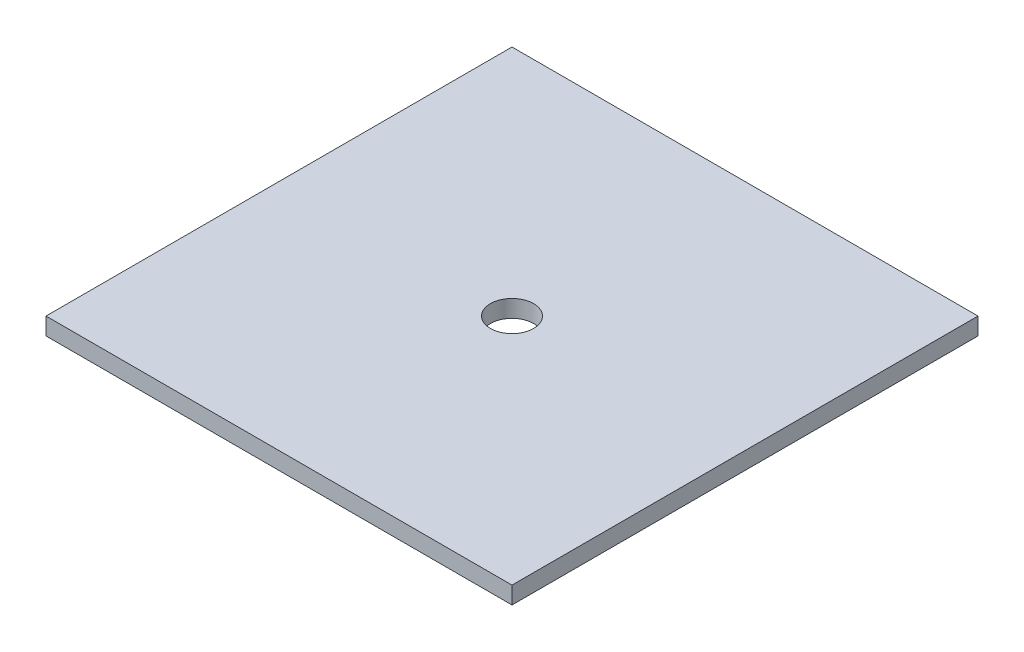
from build123d import *

# Parameters (mm, degrees)
ESBO_O2_W                = 162
ESBO_O2_H                = 162
RESSALTO_EXTRUS_O2_DEPTH = 6
ESBO_O3_R                = 7.5
CORTE_EXTRUS_O1_DEPTH    = 124.182791006


with BuildPart() as part:
    # Esboço2 → Ressalto-extrusão2 (new body)
    with BuildSketch(Plane(origin=(0, 0, 0), x_dir=(1, 0, 0), z_dir=(0, 1, 0))):
        with Locations((-6, -6)):
            Rectangle(ESBO_O2_W, ESBO_O2_H)
    extrude(amount=RESSALTO_EXTRUS_O2_DEPTH)

    # Esboço3 → Corte-extrusão1 (cut, through all)
    with BuildSketch(Plane(origin=(0, 6, 0), x_dir=(1, 0, 0), z_dir=(0, 1, 0))):
        with Locations(Location((-6, -6, 0), (0, 0, 270))):
            Circle(ESBO_O3_R)
    extrude(amount=-CORTE_EXTRUS_O1_DEPTH, mode=Mode.SUBTRACT)


solid = part.part
